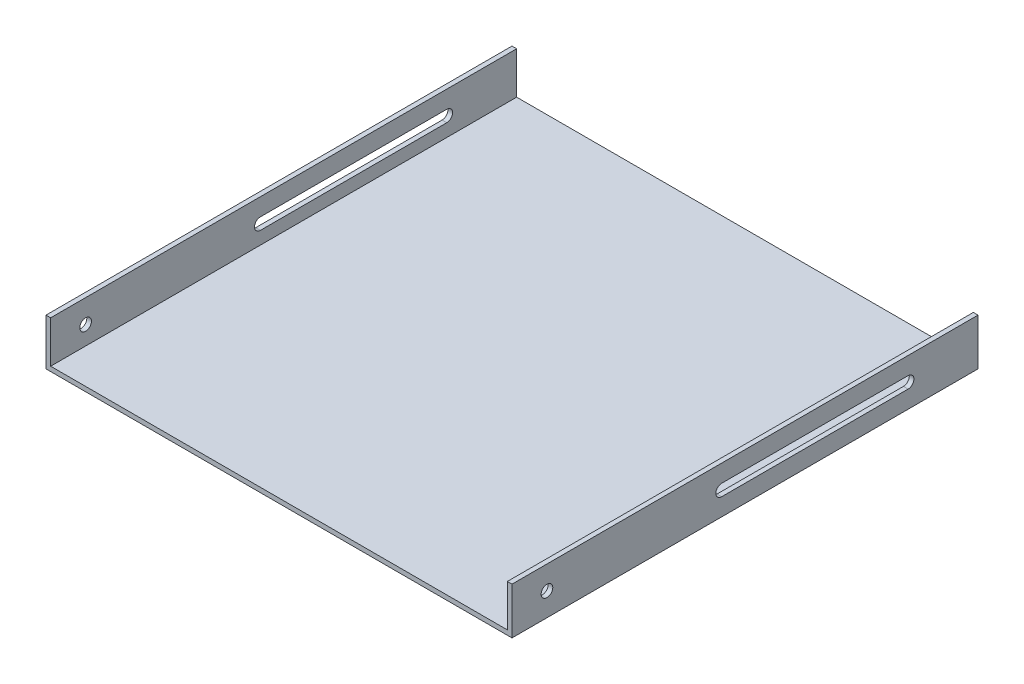
from build123d import *

# Parameters (mm, degrees)
BOSS_EXTRUDE1_DEPTH = 100
SKETCH2_R           = 2.5
CUT_EXTRUDE1_DEPTH  = 225.499443206


with BuildPart() as part:
    # Sketch1 → Boss-Extrude1 (new, symmetric)
    with BuildSketch(Plane.XY):
        Polygon((0, 20), (0, 0), (200, 0), (200, 20), (198, 20), (198, 2), (2, 2), (2, 20), align=None)
    extrude(amount=BOSS_EXTRUDE1_DEPTH, both=True)

    # Sketch2 → Cut-Extrude1 (cut, through all)
    with BuildSketch(Plane(origin=(200, 0, 0), x_dir=(0, 0, -1), z_dir=(1, 0, 0))):
        with Locations((-85, 10)):
            Circle(SKETCH2_R)
        with BuildLine():
            Line((70, 7.5), (-10, 7.5))
            ThreePointArc((-10, 7.5), (-12.5, 10), (-10, 12.5))
            Line((-10, 12.5), (70, 12.5))
            ThreePointArc((70, 12.5), (72.5, 10), (70, 7.5))
        make_face()
    extrude(amount=-CUT_EXTRUDE1_DEPTH, mode=Mode.SUBTRACT)


solid = part.part
